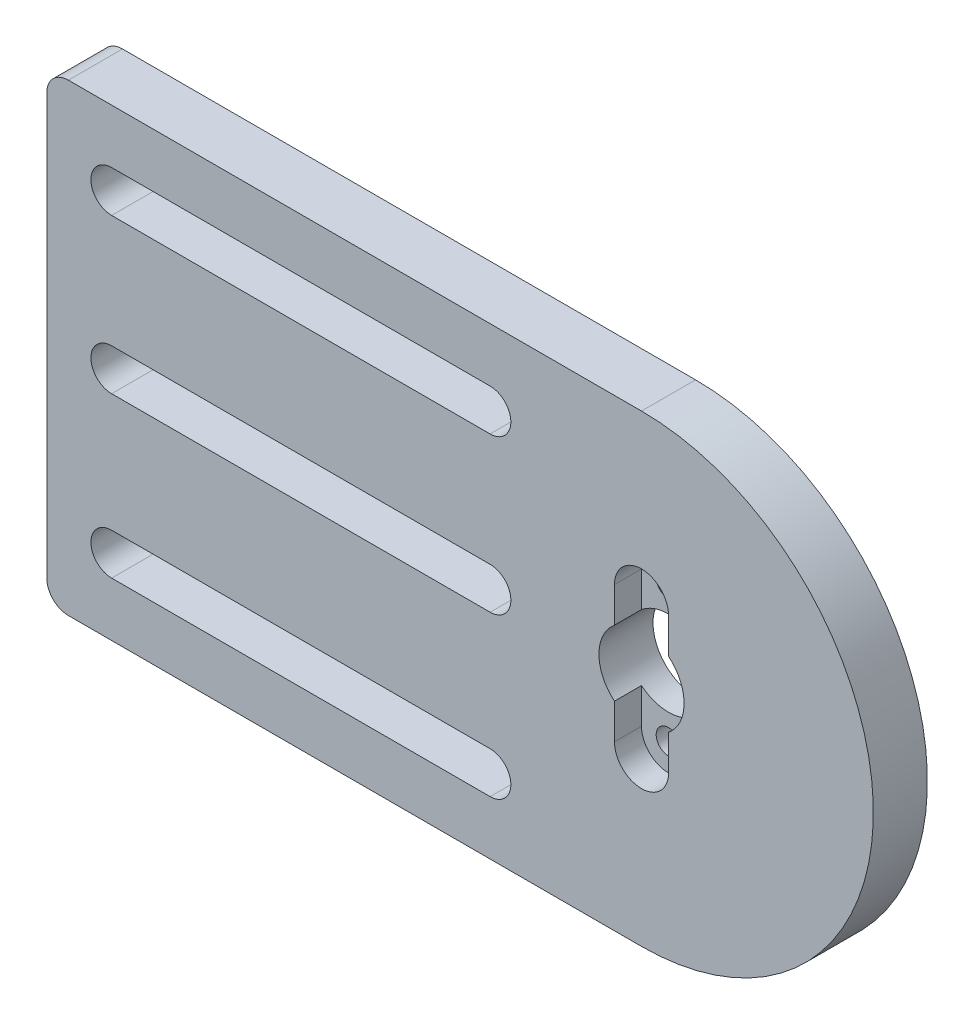
from build123d import *

# Parameters (mm, degrees)
SKETCH1_R           = 5
SKETCH1_R_2         = 1.45
BOSS_EXTRUDE1_DEPTH = 6.35
FILLET1_R           = 2.54
FILLET2_R           = 2.54
CUT_EXTRUDE1_DEPTH  = 3.175


with BuildPart() as part:
    # Sketch1 → Boss-Extrude1 (new body)
    with BuildSketch(Plane.XY):
        with BuildLine():
            Line((-4.497024954, -27.626960595), (-4.497024954, 26.828916206))
            Line((-4.497024954, 26.828916206), (65.352975046, 26.828916206))
            ThreePointArc((65.352975046, 26.828916206), (92.580913446, -0.399022195), (65.352975046, -27.626960595))
            Line((65.352975046, -27.626960595), (-4.497024954, -27.626960595))
        make_face()
        with Locations((65.352975046, -0.399022195)):
            Circle(SKETCH1_R, mode=Mode.SUBTRACT)
        with Locations((65.352975046, 7.600977805)):
            Circle(SKETCH1_R_2, mode=Mode.SUBTRACT)
        with Locations((65.352975046, -8.399022195)):
            Circle(SKETCH1_R_2, mode=Mode.SUBTRACT)
        with BuildLine():
            Line((47.572975046, 15.608916206), (3.122975046, 15.608916206))
            ThreePointArc((3.122975046, 15.608916206), (0.687975046, 18.043916206), (3.122975046, 20.478916206))
            Line((3.122975046, 20.478916206), (47.572975046, 20.478916206))
            ThreePointArc((47.572975046, 20.478916206), (50.007975046, 18.043916206), (47.572975046, 15.608916206))
        make_face(mode=Mode.SUBTRACT)
        with BuildLine():
            Line((3.122975046, 2.348787201), (47.572975046, 2.348787201))
            ThreePointArc((47.572975046, 2.348787201), (50.007975046, -0.086212799), (47.572975046, -2.521212799))
            Line((47.572975046, -2.521212799), (3.122975046, -2.521212799))
            ThreePointArc((3.122975046, -2.521212799), (0.687975046, -0.086212799), (3.122975046, 2.348787201))
        make_face(mode=Mode.SUBTRACT)
        with BuildLine():
            Line((3.122975046, -16.406960595), (47.572975046, -16.406960595))
            ThreePointArc((47.572975046, -16.406960595), (50.007975046, -18.841960595), (47.572975046, -21.276960595))
            Line((47.572975046, -21.276960595), (3.122975046, -21.276960595))
            ThreePointArc((3.122975046, -21.276960595), (0.687975046, -18.841960595), (3.122975046, -16.406960595))
        make_face(mode=Mode.SUBTRACT)
    extrude(amount=BOSS_EXTRUDE1_DEPTH)

    # Fillet1
    fillet1_edges = [part.edges().sort_by_distance(p)[0] for p in [
        (-4.497024954, -27.626960595, 3.175),
    ]]
    fillet(fillet1_edges, radius=FILLET1_R)

    # Fillet2
    fillet2_edges = [part.edges().sort_by_distance(p)[0] for p in [
        (-4.497024954, 26.828916206, 3.175),
    ]]
    fillet(fillet2_edges, radius=FILLET2_R)

    # Sketch2 → Cut-Extrude1 (cut)
    with BuildSketch(Plane.XY.offset(6.35)):
        with BuildLine():
            Line((68.527975046, 7.600977805), (68.527975046, -8.399022195))
            ThreePointArc((68.527975046, -8.399022195), (65.352975046, -11.574022195), (62.177975046, -8.399022195))
            Line((62.177975046, -8.399022195), (62.177975046, 7.600977805))
            ThreePointArc((62.177975046, 7.600977805), (65.352975046, 10.775977805), (68.527975046, 7.600977805))
        make_face()
    extrude(amount=-CUT_EXTRUDE1_DEPTH, mode=Mode.SUBTRACT)


solid = part.part
